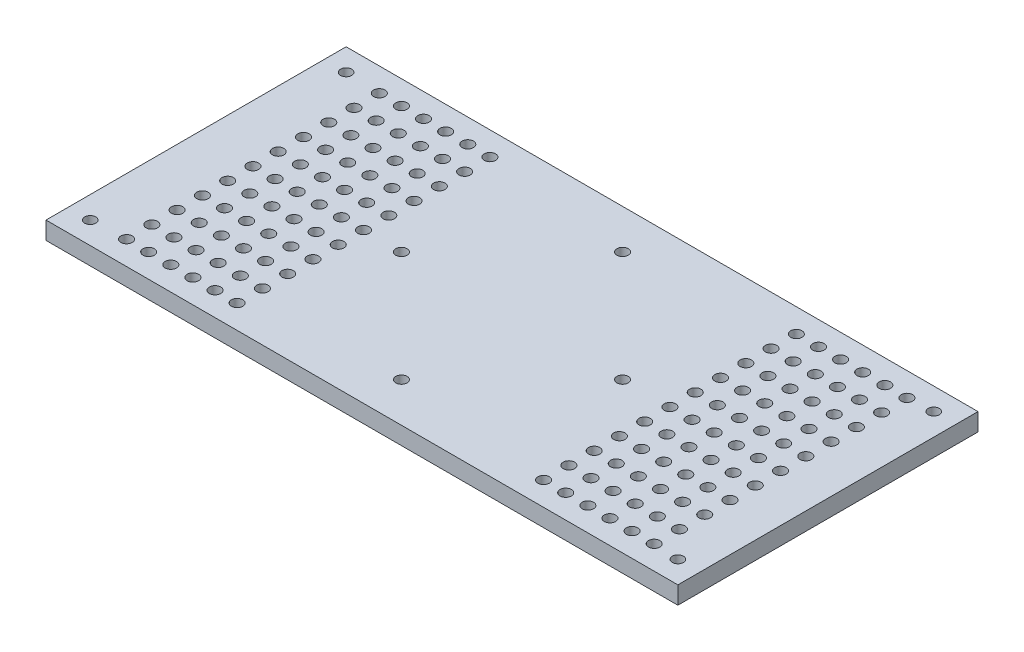
from build123d import *

# Parameters (mm, degrees)
SKETCH1_W           = 200
SKETCH1_H           = 95
BOSS_EXTRUDE1_DEPTH = 5.588
SKETCH3_R           = 1.75
SKETCH3_R_2         = 1.8
CUT_EXTRUDE2_DEPTH  = 118.875127943
SKETCH4_R           = 1.8
CUT_EXTRUDE3_DEPTH  = 118.875127943


with BuildPart() as part:
    # Sketch1 → Boss-Extrude1 (new body)
    with BuildSketch(Plane(origin=(0, 0, 0), x_dir=(1, 0, 0), z_dir=(0, 1, 0))):
        with Locations((6.013896682, 3.728641929)):
            Rectangle(SKETCH1_W, SKETCH1_H)
    extrude(amount=BOSS_EXTRUDE1_DEPTH)

    # Sketch3 → Cut-Extrude2 (cut, through all)
    with BuildSketch(Plane(origin=(0, 5.588, 0), x_dir=(1, 0, 0), z_dir=(0, 1, 0))):
        with Locations(Location((-86.986103318, -36.771358071, 0), (0, 0, 270))):
            Circle(SKETCH3_R)
        with Locations(Location((-86.986103318, 44.228641929, 0), (0, 0, 270))):
            Circle(SKETCH3_R)
        with Locations(Location((99.013896682, 44.228641929, 0), (0, 0, 270))):
            Circle(SKETCH3_R)
        with Locations(Location((99.013896682, -36.771358071, 0), (0, 0, 270))):
            Circle(SKETCH3_R)
        with Locations(Location((-28.986103318, 3.728641929, 0), (0, 0, 270))):
            Circle(SKETCH3_R_2)
        with Locations(Location((6.013896682, 38.728641929, 0), (0, 0, 270))):
            Circle(SKETCH3_R_2)
        with Locations(Location((6.013896682, -31.271358071, 0), (0, 0, 270))):
            Circle(SKETCH3_R_2)
        with Locations(Location((41.013896682, 3.728641929, 0), (0, 0, 270))):
            Circle(SKETCH3_R_2)
    extrude(amount=-CUT_EXTRUDE2_DEPTH, mode=Mode.SUBTRACT)

    # Sketch4 → Cut-Extrude3 (cut, through all)
    with BuildSketch(Plane(origin=(0, 5.588, 0), x_dir=(1, 0, 0), z_dir=(0, 1, 0))):
        with Locations(Location((-75.986103318, 43.728641929, 0), (0, 0, 270))):
            Circle(SKETCH4_R)
        with Locations(Location((56.013896682, 43.728641929, 0), (0, 0, 270))):
            Circle(SKETCH4_R)
        with Locations(Location((-68.986103318, 43.728641929, 0), (0, 0, 270))):
            Circle(SKETCH4_R)
        with Locations(Location((-61.986103318, 43.728641929, 0), (0, 0, 270))):
            Circle(SKETCH4_R)
        with Locations(Location((-54.986103318, 43.728641929, 0), (0, 0, 270))):
            Circle(SKETCH4_R)
        with Locations(Location((-47.986103318, 43.728641929, 0), (0, 0, 270))):
            Circle(SKETCH4_R)
        with Locations(Location((-40.986103318, 43.728641929, 0), (0, 0, 270))):
            Circle(SKETCH4_R)
        with Locations(Location((-68.986103318, 35.728641929, 0), (0, 0, 270))):
            Circle(SKETCH4_R)
        with Locations(Location((-61.986103318, 35.728641929, 0), (0, 0, 270))):
            Circle(SKETCH4_R)
        with Locations(Location((-54.986103318, 35.728641929, 0), (0, 0, 270))):
            Circle(SKETCH4_R)
        with Locations(Location((-47.986103318, 35.728641929, 0), (0, 0, 270))):
            Circle(SKETCH4_R)
        with Locations(Location((-40.986103318, 35.728641929, 0), (0, 0, 270))):
            Circle(SKETCH4_R)
        with Locations(Location((-68.986103318, 27.728641929, 0), (0, 0, 270))):
            Circle(SKETCH4_R)
        with Locations(Location((-61.986103318, 27.728641929, 0), (0, 0, 270))):
            Circle(SKETCH4_R)
        with Locations(Location((-54.986103318, 27.728641929, 0), (0, 0, 270))):
            Circle(SKETCH4_R)
        with Locations(Location((-47.986103318, 27.728641929, 0), (0, 0, 270))):
            Circle(SKETCH4_R)
        with Locations(Location((-40.986103318, 27.728641929, 0), (0, 0, 270))):
            Circle(SKETCH4_R)
        with Locations(Location((-68.986103318, 19.728641929, 0), (0, 0, 270))):
            Circle(SKETCH4_R)
        with Locations(Location((-61.986103318, 19.728641929, 0), (0, 0, 270))):
            Circle(SKETCH4_R)
        with Locations(Location((-54.986103318, 19.728641929, 0), (0, 0, 270))):
            Circle(SKETCH4_R)
        with Locations(Location((-47.986103318, 19.728641929, 0), (0, 0, 270))):
            Circle(SKETCH4_R)
        with Locations(Location((-40.986103318, 19.728641929, 0), (0, 0, 270))):
            Circle(SKETCH4_R)
        with Locations(Location((-68.986103318, 11.728641929, 0), (0, 0, 270))):
            Circle(SKETCH4_R)
        with Locations(Location((-61.986103318, 11.728641929, 0), (0, 0, 270))):
            Circle(SKETCH4_R)
        with Locations(Location((-54.986103318, 11.728641929, 0), (0, 0, 270))):
            Circle(SKETCH4_R)
        with Locations(Location((-47.986103318, 11.728641929, 0), (0, 0, 270))):
            Circle(SKETCH4_R)
        with Locations(Location((-40.986103318, 11.728641929, 0), (0, 0, 270))):
            Circle(SKETCH4_R)
        with Locations(Location((-68.986103318, 3.728641929, 0), (0, 0, 270))):
            Circle(SKETCH4_R)
        with Locations(Location((-61.986103318, 3.728641929, 0), (0, 0, 270))):
            Circle(SKETCH4_R)
        with Locations(Location((-54.986103318, 3.728641929, 0), (0, 0, 270))):
            Circle(SKETCH4_R)
        with Locations(Location((-47.986103318, 3.728641929, 0), (0, 0, 270))):
            Circle(SKETCH4_R)
        with Locations(Location((-40.986103318, 3.728641929, 0), (0, 0, 270))):
            Circle(SKETCH4_R)
        with Locations(Location((-68.986103318, -4.271358071, 0), (0, 0, 270))):
            Circle(SKETCH4_R)
        with Locations(Location((-61.986103318, -4.271358071, 0), (0, 0, 270))):
            Circle(SKETCH4_R)
        with Locations(Location((-54.986103318, -4.271358071, 0), (0, 0, 270))):
            Circle(SKETCH4_R)
        with Locations(Location((-47.986103318, -4.271358071, 0), (0, 0, 270))):
            Circle(SKETCH4_R)
        with Locations(Location((-40.986103318, -4.271358071, 0), (0, 0, 270))):
            Circle(SKETCH4_R)
        with Locations(Location((-68.986103318, -12.271358071, 0), (0, 0, 270))):
            Circle(SKETCH4_R)
        with Locations(Location((-61.986103318, -12.271358071, 0), (0, 0, 270))):
            Circle(SKETCH4_R)
        with Locations(Location((-54.986103318, -12.271358071, 0), (0, 0, 270))):
            Circle(SKETCH4_R)
        with Locations(Location((-47.986103318, -12.271358071, 0), (0, 0, 270))):
            Circle(SKETCH4_R)
        with Locations(Location((-40.986103318, -12.271358071, 0), (0, 0, 270))):
            Circle(SKETCH4_R)
        with Locations(Location((-68.986103318, -20.271358071, 0), (0, 0, 270))):
            Circle(SKETCH4_R)
        with Locations(Location((-61.986103318, -20.271358071, 0), (0, 0, 270))):
            Circle(SKETCH4_R)
        with Locations(Location((-54.986103318, -20.271358071, 0), (0, 0, 270))):
            Circle(SKETCH4_R)
        with Locations(Location((-47.986103318, -20.271358071, 0), (0, 0, 270))):
            Circle(SKETCH4_R)
        with Locations(Location((-40.986103318, -20.271358071, 0), (0, 0, 270))):
            Circle(SKETCH4_R)
        with Locations(Location((-68.986103318, -28.271358071, 0), (0, 0, 270))):
            Circle(SKETCH4_R)
        with Locations(Location((-61.986103318, -28.271358071, 0), (0, 0, 270))):
            Circle(SKETCH4_R)
        with Locations(Location((-54.986103318, -28.271358071, 0), (0, 0, 270))):
            Circle(SKETCH4_R)
        with Locations(Location((-47.986103318, -28.271358071, 0), (0, 0, 270))):
            Circle(SKETCH4_R)
        with Locations(Location((-40.986103318, -28.271358071, 0), (0, 0, 270))):
            Circle(SKETCH4_R)
        with Locations(Location((-68.986103318, -36.271358071, 0), (0, 0, 270))):
            Circle(SKETCH4_R)
        with Locations(Location((-61.986103318, -36.271358071, 0), (0, 0, 270))):
            Circle(SKETCH4_R)
        with Locations(Location((-54.986103318, -36.271358071, 0), (0, 0, 270))):
            Circle(SKETCH4_R)
        with Locations(Location((-47.986103318, -36.271358071, 0), (0, 0, 270))):
            Circle(SKETCH4_R)
        with Locations(Location((-40.986103318, -36.271358071, 0), (0, 0, 270))):
            Circle(SKETCH4_R)
        with Locations(Location((-75.986103318, 35.728641929, 0), (0, 0, 270))):
            Circle(SKETCH4_R)
        with Locations(Location((-75.986103318, 27.728641929, 0), (0, 0, 270))):
            Circle(SKETCH4_R)
        with Locations(Location((-75.986103318, 19.728641929, 0), (0, 0, 270))):
            Circle(SKETCH4_R)
        with Locations(Location((-75.986103318, 11.728641929, 0), (0, 0, 270))):
            Circle(SKETCH4_R)
        with Locations(Location((-75.986103318, 3.728641929, 0), (0, 0, 270))):
            Circle(SKETCH4_R)
        with Locations(Location((-75.986103318, -4.271358071, 0), (0, 0, 270))):
            Circle(SKETCH4_R)
        with Locations(Location((-75.986103318, -12.271358071, 0), (0, 0, 270))):
            Circle(SKETCH4_R)
        with Locations(Location((-75.986103318, -20.271358071, 0), (0, 0, 270))):
            Circle(SKETCH4_R)
        with Locations(Location((-75.986103318, -28.271358071, 0), (0, 0, 270))):
            Circle(SKETCH4_R)
        with Locations(Location((-75.986103318, -36.271358071, 0), (0, 0, 270))):
            Circle(SKETCH4_R)
        with Locations(Location((63.013896682, 43.728641929, 0), (0, 0, 270))):
            Circle(SKETCH4_R)
        with Locations(Location((70.013896682, 43.728641929, 0), (0, 0, 270))):
            Circle(SKETCH4_R)
        with Locations(Location((77.013896682, 43.728641929, 0), (0, 0, 270))):
            Circle(SKETCH4_R)
        with Locations(Location((84.013896682, 43.728641929, 0), (0, 0, 270))):
            Circle(SKETCH4_R)
        with Locations(Location((91.013896682, 43.728641929, 0), (0, 0, 270))):
            Circle(SKETCH4_R)
        with Locations(Location((63.013896682, 35.728641929, 0), (0, 0, 270))):
            Circle(SKETCH4_R)
        with Locations(Location((70.013896682, 35.728641929, 0), (0, 0, 270))):
            Circle(SKETCH4_R)
        with Locations(Location((77.013896682, 35.728641929, 0), (0, 0, 270))):
            Circle(SKETCH4_R)
        with Locations(Location((84.013896682, 35.728641929, 0), (0, 0, 270))):
            Circle(SKETCH4_R)
        with Locations(Location((91.013896682, 35.728641929, 0), (0, 0, 270))):
            Circle(SKETCH4_R)
        with Locations(Location((63.013896682, 27.728641929, 0), (0, 0, 270))):
            Circle(SKETCH4_R)
        with Locations(Location((70.013896682, 27.728641929, 0), (0, 0, 270))):
            Circle(SKETCH4_R)
        with Locations(Location((77.013896682, 27.728641929, 0), (0, 0, 270))):
            Circle(SKETCH4_R)
        with Locations(Location((84.013896682, 27.728641929, 0), (0, 0, 270))):
            Circle(SKETCH4_R)
        with Locations(Location((91.013896682, 27.728641929, 0), (0, 0, 270))):
            Circle(SKETCH4_R)
        with Locations(Location((63.013896682, 19.728641929, 0), (0, 0, 270))):
            Circle(SKETCH4_R)
        with Locations(Location((70.013896682, 19.728641929, 0), (0, 0, 270))):
            Circle(SKETCH4_R)
        with Locations(Location((77.013896682, 19.728641929, 0), (0, 0, 270))):
            Circle(SKETCH4_R)
        with Locations(Location((84.013896682, 19.728641929, 0), (0, 0, 270))):
            Circle(SKETCH4_R)
        with Locations(Location((91.013896682, 19.728641929, 0), (0, 0, 270))):
            Circle(SKETCH4_R)
        with Locations(Location((63.013896682, 11.728641929, 0), (0, 0, 270))):
            Circle(SKETCH4_R)
        with Locations(Location((70.013896682, 11.728641929, 0), (0, 0, 270))):
            Circle(SKETCH4_R)
        with Locations(Location((77.013896682, 11.728641929, 0), (0, 0, 270))):
            Circle(SKETCH4_R)
        with Locations(Location((84.013896682, 11.728641929, 0), (0, 0, 270))):
            Circle(SKETCH4_R)
        with Locations(Location((91.013896682, 11.728641929, 0), (0, 0, 270))):
            Circle(SKETCH4_R)
        with Locations(Location((63.013896682, 3.728641929, 0), (0, 0, 270))):
            Circle(SKETCH4_R)
        with Locations(Location((70.013896682, 3.728641929, 0), (0, 0, 270))):
            Circle(SKETCH4_R)
        with Locations(Location((77.013896682, 3.728641929, 0), (0, 0, 270))):
            Circle(SKETCH4_R)
        with Locations(Location((84.013896682, 3.728641929, 0), (0, 0, 270))):
            Circle(SKETCH4_R)
        with Locations(Location((91.013896682, 3.728641929, 0), (0, 0, 270))):
            Circle(SKETCH4_R)
        with Locations(Location((63.013896682, -4.271358071, 0), (0, 0, 270))):
            Circle(SKETCH4_R)
        with Locations(Location((70.013896682, -4.271358071, 0), (0, 0, 270))):
            Circle(SKETCH4_R)
        with Locations(Location((77.013896682, -4.271358071, 0), (0, 0, 270))):
            Circle(SKETCH4_R)
        with Locations(Location((84.013896682, -4.271358071, 0), (0, 0, 270))):
            Circle(SKETCH4_R)
        with Locations(Location((91.013896682, -4.271358071, 0), (0, 0, 270))):
            Circle(SKETCH4_R)
        with Locations(Location((63.013896682, -12.271358071, 0), (0, 0, 270))):
            Circle(SKETCH4_R)
        with Locations(Location((70.013896682, -12.271358071, 0), (0, 0, 270))):
            Circle(SKETCH4_R)
        with Locations(Location((77.013896682, -12.271358071, 0), (0, 0, 270))):
            Circle(SKETCH4_R)
        with Locations(Location((84.013896682, -12.271358071, 0), (0, 0, 270))):
            Circle(SKETCH4_R)
        with Locations(Location((91.013896682, -12.271358071, 0), (0, 0, 270))):
            Circle(SKETCH4_R)
        with Locations(Location((63.013896682, -20.271358071, 0), (0, 0, 270))):
            Circle(SKETCH4_R)
        with Locations(Location((70.013896682, -20.271358071, 0), (0, 0, 270))):
            Circle(SKETCH4_R)
        with Locations(Location((77.013896682, -20.271358071, 0), (0, 0, 270))):
            Circle(SKETCH4_R)
        with Locations(Location((84.013896682, -20.271358071, 0), (0, 0, 270))):
            Circle(SKETCH4_R)
        with Locations(Location((91.013896682, -20.271358071, 0), (0, 0, 270))):
            Circle(SKETCH4_R)
        with Locations(Location((63.013896682, -28.271358071, 0), (0, 0, 270))):
            Circle(SKETCH4_R)
        with Locations(Location((70.013896682, -28.271358071, 0), (0, 0, 270))):
            Circle(SKETCH4_R)
        with Locations(Location((77.013896682, -28.271358071, 0), (0, 0, 270))):
            Circle(SKETCH4_R)
        with Locations(Location((84.013896682, -28.271358071, 0), (0, 0, 270))):
            Circle(SKETCH4_R)
        with Locations(Location((91.013896682, -28.271358071, 0), (0, 0, 270))):
            Circle(SKETCH4_R)
        with Locations(Location((63.013896682, -36.271358071, 0), (0, 0, 270))):
            Circle(SKETCH4_R)
        with Locations(Location((70.013896682, -36.271358071, 0), (0, 0, 270))):
            Circle(SKETCH4_R)
        with Locations(Location((77.013896682, -36.271358071, 0), (0, 0, 270))):
            Circle(SKETCH4_R)
        with Locations(Location((84.013896682, -36.271358071, 0), (0, 0, 270))):
            Circle(SKETCH4_R)
        with Locations(Location((91.013896682, -36.271358071, 0), (0, 0, 270))):
            Circle(SKETCH4_R)
        with Locations(Location((56.013896682, 35.728641929, 0), (0, 0, 270))):
            Circle(SKETCH4_R)
        with Locations(Location((56.013896682, 27.728641929, 0), (0, 0, 270))):
            Circle(SKETCH4_R)
        with Locations(Location((56.013896682, 19.728641929, 0), (0, 0, 270))):
            Circle(SKETCH4_R)
        with Locations(Location((56.013896682, 11.728641929, 0), (0, 0, 270))):
            Circle(SKETCH4_R)
        with Locations(Location((56.013896682, 3.728641929, 0), (0, 0, 270))):
            Circle(SKETCH4_R)
        with Locations(Location((56.013896682, -4.271358071, 0), (0, 0, 270))):
            Circle(SKETCH4_R)
        with Locations(Location((56.013896682, -12.271358071, 0), (0, 0, 270))):
            Circle(SKETCH4_R)
        with Locations(Location((56.013896682, -20.271358071, 0), (0, 0, 270))):
            Circle(SKETCH4_R)
        with Locations(Location((56.013896682, -28.271358071, 0), (0, 0, 270))):
            Circle(SKETCH4_R)
        with Locations(Location((56.013896682, -36.271358071, 0), (0, 0, 270))):
            Circle(SKETCH4_R)
    extrude(amount=-CUT_EXTRUDE3_DEPTH, mode=Mode.SUBTRACT)


solid = part.part
